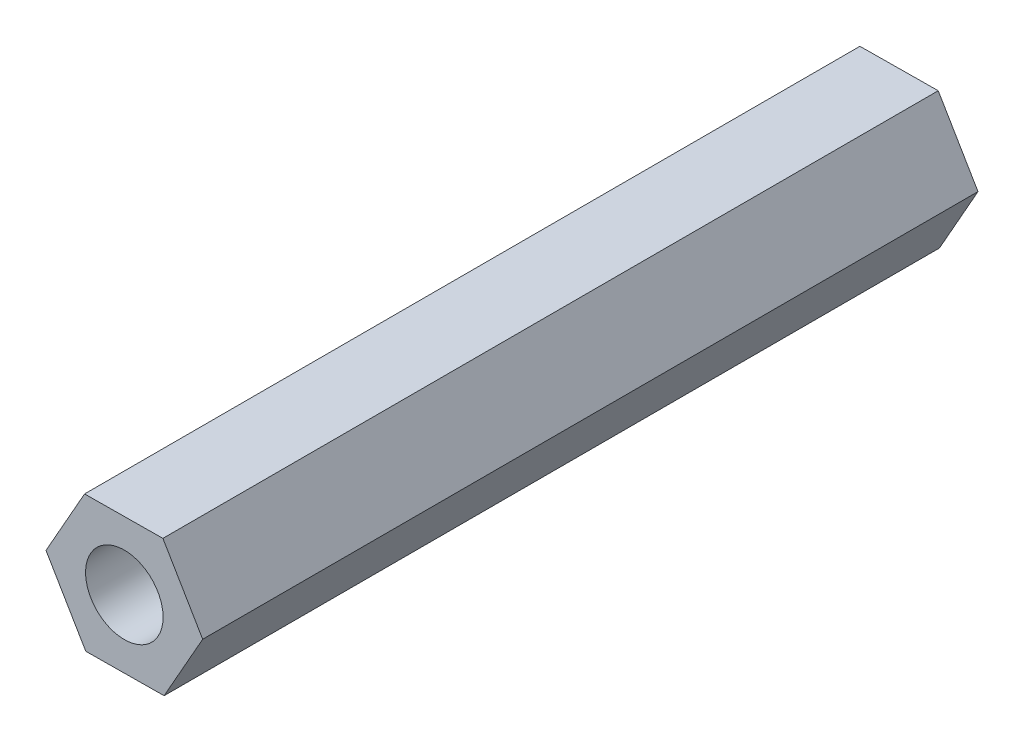
from build123d import *

# Parameters (mm, degrees)
SKETCH_1_R      = 2
EXTRUDE_1_DEPTH = 40


with BuildPart() as part:
    # 草图1 → 凸台-拉伸1 (new body)
    with BuildSketch(Plane.XY):
        Polygon((2.051456248, -3.482077052), (4.041295309, 0.035574699), (1.989839061, 3.517651751), (-2.051456248, 3.482077052), (-4.041295309, -0.035574699), (-1.989839061, -3.517651751), align=None)
        Circle(SKETCH_1_R, mode=Mode.SUBTRACT)
    extrude(amount=EXTRUDE_1_DEPTH)


solid = part.part
